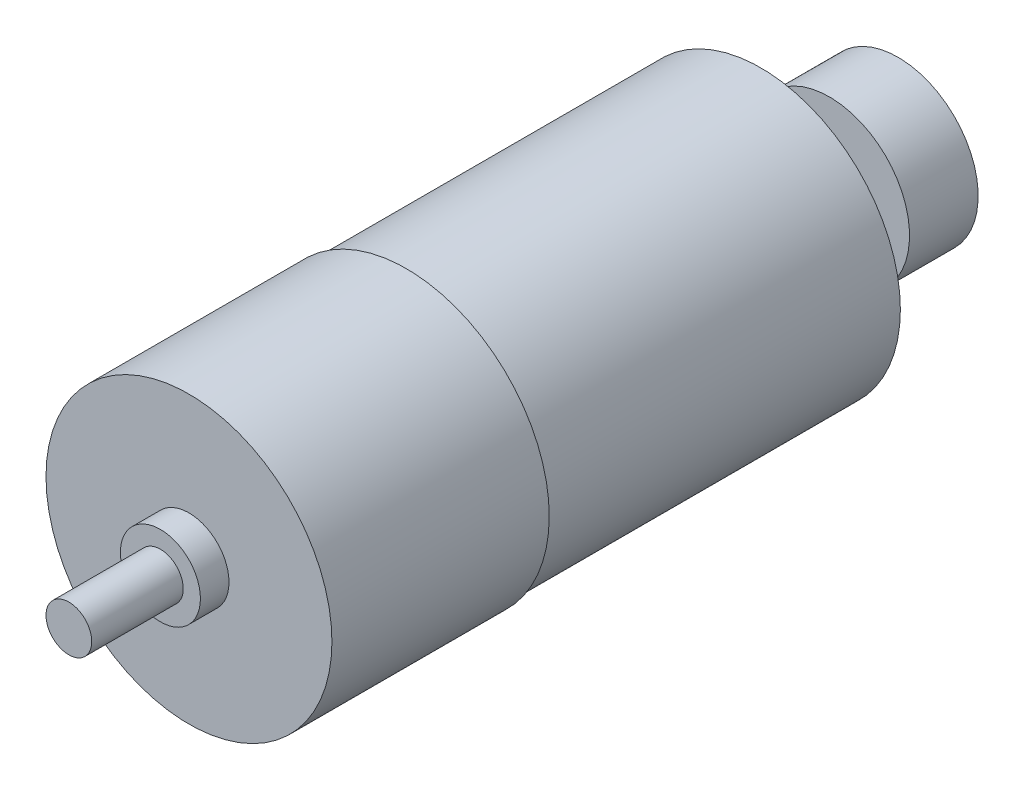
from build123d import *

# Parameters (mm, degrees)
CROQUIS1_R              = 12.5
SALIENTE_EXTRUIR1_DEPTH = 19
CROQUIS3_R              = 3.5
SALIENTE_EXTRUIR2_DEPTH = 2.5
CROQUIS4_R              = 2
SALIENTE_EXTRUIR3_DEPTH = 8
CROQUIS5_R              = 12.2
SALIENTE_EXTRUIR4_DEPTH = 31
SALIENTE_EXTRUIR5_START = 6
CROQUIS6_R              = 2
SALIENTE_EXTRUIR5_DEPTH = 6
CROQUIS7_R              = 7
SALIENTE_EXTRUIR6_DEPTH = 6


with BuildPart() as part:
    # Croquis1 → Saliente-Extruir1 (new body)
    with BuildSketch(Plane.XY):
        Circle(CROQUIS1_R)
    extrude(amount=SALIENTE_EXTRUIR1_DEPTH)

    # Croquis3 → Saliente-Extruir2 (add)
    with BuildSketch(Plane.XY.offset(19)):
        Circle(CROQUIS3_R)
    extrude(amount=SALIENTE_EXTRUIR2_DEPTH)

    # Croquis4 → Saliente-Extruir3 (add)
    with BuildSketch(Plane.XY.offset(21.5)):
        Circle(CROQUIS4_R)
    extrude(amount=SALIENTE_EXTRUIR3_DEPTH)

    # Croquis5 → Saliente-Extruir4 (add)
    with BuildSketch(Plane(origin=(0, 0, 0), x_dir=(-1, 0, 0), z_dir=(0, 0, -1))):
        Circle(CROQUIS5_R)
    extrude(amount=SALIENTE_EXTRUIR4_DEPTH)

    # Croquis6 → Saliente-Extruir5 (add)
    with BuildSketch(Plane(origin=(0, 0, -31), x_dir=(-1, 0, 0), z_dir=(0, 0, -1)).offset(SALIENTE_EXTRUIR5_START)):
        with Locations(Location((0, 0, 0), (0, 0, 180))):
            Circle(CROQUIS6_R)
    extrude(amount=-SALIENTE_EXTRUIR5_DEPTH)

    # Croquis7 → Saliente-Extruir6 (add)
    with BuildSketch(Plane(origin=(0, 0, -37), x_dir=(-1, 0, 0), z_dir=(0, 0, -1))):
        Circle(CROQUIS7_R)
    extrude(amount=SALIENTE_EXTRUIR6_DEPTH)


solid = part.part
